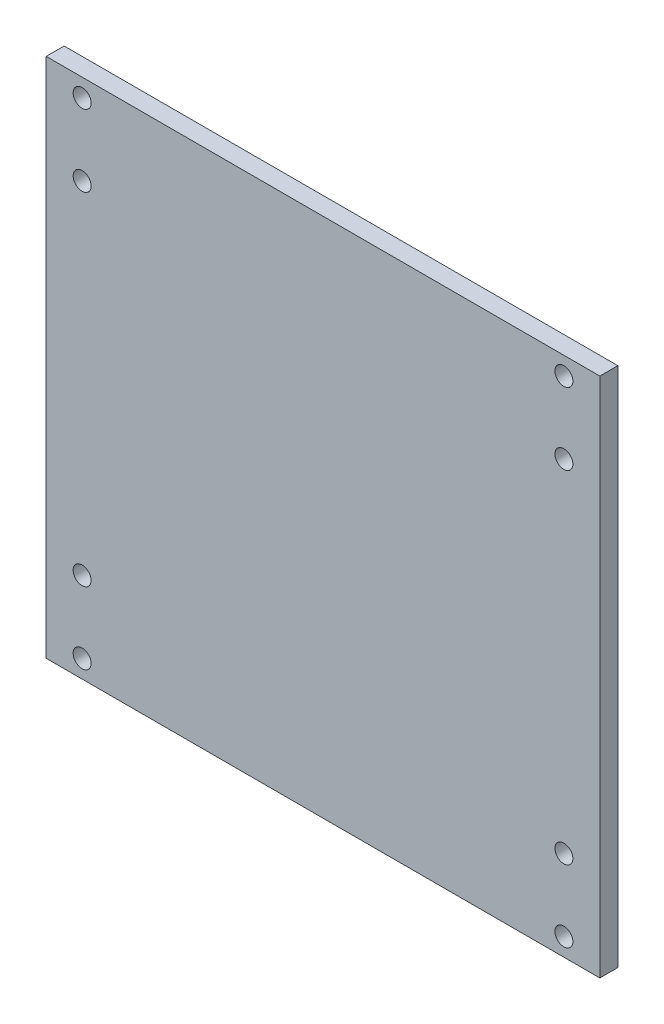
from build123d import *

# Parameters (mm, degrees)
SKETCH_1_W      = 61.6
SKETCH_1_H      = 58
SKETCH_1_R      = 1
EXTRUDE_1_DEPTH = 2


with BuildPart() as part:
    # 草圖1 → 填料-伸長1 (new body)
    with BuildSketch(Plane.XY):
        with Locations((-4.507156781, -0.436090226)):
            Rectangle(SKETCH_1_W, SKETCH_1_H)
        with Locations((-31.307156781, 26.563909774)):
            Circle(SKETCH_1_R, mode=Mode.SUBTRACT)
        with Locations((-31.307156781, 18.563909774)):
            Circle(SKETCH_1_R, mode=Mode.SUBTRACT)
        with Locations(Location((22.292843219, 18.563909774, 0), (0, 0, 180))):
            Circle(SKETCH_1_R, mode=Mode.SUBTRACT)
        with Locations(Location((22.292843219, 26.563909774, 0), (0, 0, 180))):
            Circle(SKETCH_1_R, mode=Mode.SUBTRACT)
        with Locations((22.292843219, -27.436090226)):
            Circle(SKETCH_1_R, mode=Mode.SUBTRACT)
        with Locations((22.292843219, -19.436090226)):
            Circle(SKETCH_1_R, mode=Mode.SUBTRACT)
        with Locations(Location((-31.307156781, -19.436090226, 0), (0, 0, 180))):
            Circle(SKETCH_1_R, mode=Mode.SUBTRACT)
        with Locations(Location((-31.307156781, -27.436090226, 0), (0, 0, 180))):
            Circle(SKETCH_1_R, mode=Mode.SUBTRACT)
    extrude(amount=EXTRUDE_1_DEPTH)


solid = part.part
